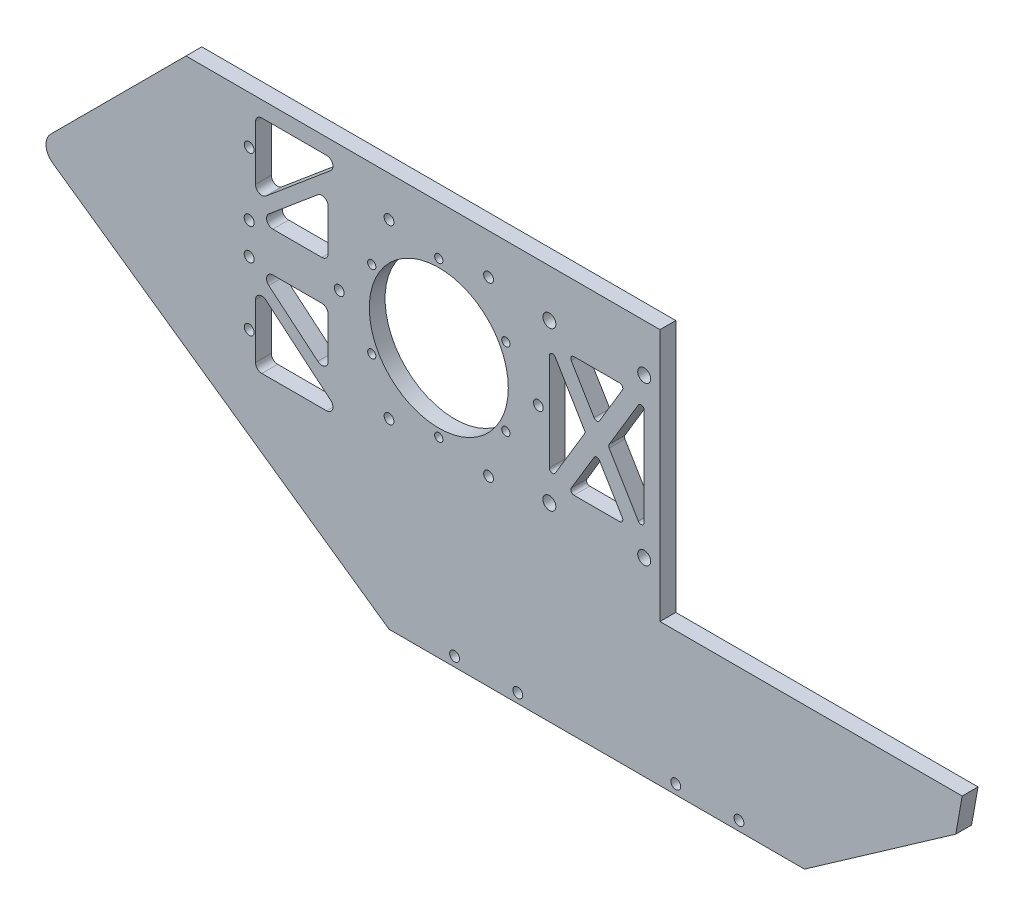
from build123d import *

# Parameters (mm, degrees)
SKETCH_1_W             = 150
SKETCH_1_H             = 80
SKETCH_1_R             = 1.3
SKETCH_1_R_2           = 22
EXTRUDE_1_DEPTH        = 5
SKETCH_3_R             = 1.55
SKETCH_3_R_2           = 1.582849294
CUT_EXTRUDE_3_DEPTH    = 12.5
CUT_EXTRUDE_5_DEPTH    = 8
FILLET_3_R             = 2
FILLET_3_OF_MIRROR_2_R = 2
EXTRUDE_4_DEPTH        = 5
FILLET_5_R             = 5
SKETCH_11_R            = 1.55
CUT_EXTRUDE_7_DEPTH    = 25
SKETCH_12_R            = 2.05
CUT_EXTRUDE_8_DEPTH    = 10
CUT_EXTRUDE_9_DEPTH    = 10
FILLET_6_R             = 1
SKETCH_14_R            = 2.25
CUT_EXTRUDE_10_DEPTH   = 2.5
EXTRUDE_5_DEPTH        = 5
CHAMFER_1_SIZE         = 20
CHAMFER_1_SIZE2        = 14.360300861
SKETCH_16_R            = 1.55
CUT_EXTRUDE_11_DEPTH   = 10.5


with BuildPart() as part:
    # 草图1 → 凸台-拉伸1 (new body)
    with BuildSketch(Plane.XY):
        with Locations((-5, 0)):
            Rectangle(SKETCH_1_W, SKETCH_1_H)
        with Locations((0, -24.5)):
            Circle(SKETCH_1_R, mode=Mode.SUBTRACT)
        with Locations((-21.217622393, -12.25)):
            Circle(SKETCH_1_R, mode=Mode.SUBTRACT)
        with Locations((-21.217622393, 12.25)):
            Circle(SKETCH_1_R, mode=Mode.SUBTRACT)
        Circle(SKETCH_1_R_2, mode=Mode.SUBTRACT)
        with Locations((0, 24.5)):
            Circle(SKETCH_1_R, mode=Mode.SUBTRACT)
        with Locations((21.217622393, 12.25)):
            Circle(SKETCH_1_R, mode=Mode.SUBTRACT)
        with Locations((21.217622393, -12.25)):
            Circle(SKETCH_1_R, mode=Mode.SUBTRACT)
    extrude(amount=EXTRUDE_1_DEPTH)

    # 草图3 → 切除-拉伸3 (cut)
    with BuildSketch(Plane.XY.offset(5)):
        with Locations((-60, -25)):
            Circle(SKETCH_3_R)
        with Locations((-60, -5)):
            Circle(SKETCH_3_R_2)
        with Locations((-60, 25)):
            Circle(SKETCH_3_R)
        with Locations((-60, 5)):
            Circle(SKETCH_3_R_2)
    extrude(amount=-CUT_EXTRUDE_3_DEPTH, mode=Mode.SUBTRACT)

    # 草图4 → 切除-拉伸5 (cut)
    with BuildSketch(Plane.XY.offset(5)):
        Polygon((-58, 35), (-30, 35), (-58, 11.505210327), align=None)
        Polygon((-35, 25.582872687), (-58, 6.28358117), (-35, 6.28358117), align=None)
    cut_extrude_5 = extrude(amount=-CUT_EXTRUDE_5_DEPTH, mode=Mode.SUBTRACT)

    # 圆角3
    fillet_3_edges = [part.edges().sort_by_distance(p)[0] for p in [
        (-35, 6.28358117, 2.5),
        (-58, 6.28358117, 2.5),
        (-35, 25.582872687, 2.5),
        (-30, 35, 2.5),
        (-58, 11.505210327, 2.5),
        (-58, 35, 2.5),
    ]]
    fillet(fillet_3_edges, radius=FILLET_3_R)

    # 镜向2: 切除-拉伸5 across plane
    add(cut_extrude_5.mirror(Plane.ZX), mode=Mode.SUBTRACT)

    # 圆角3 of 镜向2
    fillet_3_of_mirror_2_edges = [part.edges().sort_by_distance(p)[0] for p in [
        (-35, -6.28358117, 2.5),
        (-58, -6.28358117, 2.5),
        (-35, -25.582872687, 2.5),
        (-30, -35, 2.5),
        (-58, -11.505210327, 2.5),
        (-58, -35, 2.5),
    ]]
    fillet(fillet_3_of_mirror_2_edges, radius=FILLET_3_OF_MIRROR_2_R)

    # 草图10 → 凸台-拉伸4 (add)
    with BuildSketch(Plane.XY.offset(5)):
        Polygon((-80, -40), (-127.053079228, -7.053079228), (-80, 40), align=None)
    extrude(amount=-EXTRUDE_4_DEPTH)

    # 圆角5
    fillet_5_edges = [part.edges().sort_by_distance(p)[0] for p in [
        (-127.053079228, -7.053079228, 2.5),
    ]]
    fillet(fillet_5_edges, radius=FILLET_5_R)

    # 草图11 → 切除-拉伸7 (cut)
    with BuildSketch(Plane.XY.offset(5)):
        with Locations((-15.75, 27.279800219)):
            Circle(SKETCH_11_R)
        with Locations((15.75, 27.279800219)):
            Circle(SKETCH_11_R)
        with Locations((31.5, 0)):
            Circle(SKETCH_11_R)
        with Locations((15.75, -27.279800219)):
            Circle(SKETCH_11_R)
        with Locations((-15.75, -27.279800219)):
            Circle(SKETCH_11_R)
        with Locations((-31.5, 0)):
            Circle(SKETCH_11_R)
    extrude(amount=-CUT_EXTRUDE_7_DEPTH, mode=Mode.SUBTRACT)

    # 草图12 → 切除-拉伸8 (cut)
    with BuildSketch(Plane.XY.offset(5)):
        with Locations((35, 25)):
            Circle(SKETCH_12_R)
        with Locations((65, 25)):
            Circle(SKETCH_12_R)
        with Locations((65, -25)):
            Circle(SKETCH_12_R)
        with Locations((35, -25)):
            Circle(SKETCH_12_R)
    extrude(amount=-CUT_EXTRUDE_8_DEPTH, mode=Mode.SUBTRACT)

    # 草图13 → 切除-拉伸9 (cut)
    with BuildSketch(Plane.XY.offset(5)):
        Polygon((35, 19), (35, -19), (46.4, 0), align=None)
        Polygon((65, -19), (53.6, 0), (65, 19), align=None)
        Polygon((41, 19), (50, 4), (59, 19), align=None)
        Polygon((50, -4), (59, -19), (41, -19), align=None)
    extrude(amount=-CUT_EXTRUDE_9_DEPTH, mode=Mode.SUBTRACT)

    # 圆角6
    fillet_6_edges = [part.edges().sort_by_distance(p)[0] for p in [
        (41, 19, 2.5),
        (59, 19, 2.5),
        (50, 4, 2.5),
        (65, 19, 2.5),
        (65, -19, 2.5),
        (53.6, 0, 2.5),
        (41, -19, 2.5),
        (50, -4, 2.5),
        (59, -19, 2.5),
        (35, 19, 2.5),
        (46.4, 0, 2.5),
        (35, -19, 2.5),
    ]]
    fillet(fillet_6_edges, radius=FILLET_6_R)

    # 草图14 → 切除-拉伸10 (cut)
    with BuildSketch(Plane(origin=(0, 0, 0), x_dir=(-1, 0, 0), z_dir=(0, 0, -1))):
        with Locations((0, 24.5)):
            Circle(SKETCH_14_R)
        with Locations((21.217622393, 12.25)):
            Circle(SKETCH_14_R)
        with Locations((21.217622393, -12.25)):
            Circle(SKETCH_14_R)
        with Locations((0, -24.5)):
            Circle(SKETCH_14_R)
        with Locations((-21.217622393, -12.25)):
            Circle(SKETCH_14_R)
        with Locations((-21.217622393, 12.25)):
            Circle(SKETCH_14_R)
    extrude(amount=-CUT_EXTRUDE_10_DEPTH, mode=Mode.SUBTRACT)

    # 草图15 → 凸台-拉伸5 (add)
    with BuildSketch(Plane(origin=(0, 0, 0), x_dir=(-1, 0, 0), z_dir=(0, 0, -1))):
        Polygon((15.733339697, -85), (80, -40), (-50, -40), (-50, -85), align=None)
        Polygon((-50, -85), (-50, -40), (-180, -40), (-115.733339697, -85), align=None)
    extrude(amount=-EXTRUDE_5_DEPTH)

    # 倒角1
    chamfer_1_edges = [part.edges().sort_by_distance(p)[0] for p in [
        (180, -40, 2.5),
    ]]
    chamfer_1_side = [part.faces().sort_by_distance(p)[0] for p in [
        (147.866669848, -62.5, 2.5),
    ]]
    chamfer(chamfer_1_edges, length=CHAMFER_1_SIZE, length2=CHAMFER_1_SIZE2, reference=chamfer_1_side[0])

    # 草图16 → 切除-拉伸11 (cut)
    with BuildSketch(Plane(origin=(0, 0, 0), x_dir=(-1, 0, 0), z_dir=(0, 0, -1))):
        with Locations((-95, -82)):
            Circle(SKETCH_16_R)
        with Locations((-75, -82)):
            Circle(SKETCH_16_R)
        with Locations((-25, -82)):
            Circle(SKETCH_16_R)
        with Locations((-5, -82)):
            Circle(SKETCH_16_R)
    extrude(amount=-CUT_EXTRUDE_11_DEPTH, mode=Mode.SUBTRACT)


solid = part.part
